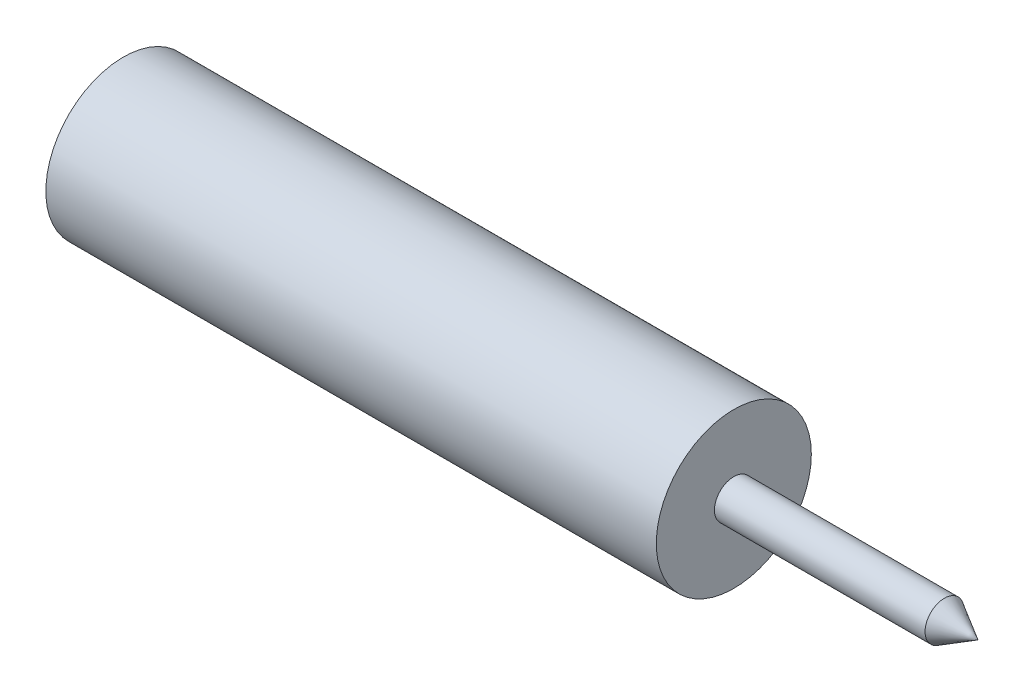
from build123d import *


with BuildPart() as part:
    # Sketch1 → Revolve1 (revolve)
    with BuildSketch(Plane.XY, mode=Mode.PRIVATE) as revolve1_sk:
        Polygon((0, 0), (0, 6.35), (50, 6.35), (50, 1.5875), (67.250369343, 1.5875), (70, 0), align=None)
    revolve(revolve1_sk.sketch.rotate(Axis((0, 0, 0), (-1, 0, 0)), 90), axis=Axis((0, 0, 0), (-1, 0, 0)))


solid = part.part
